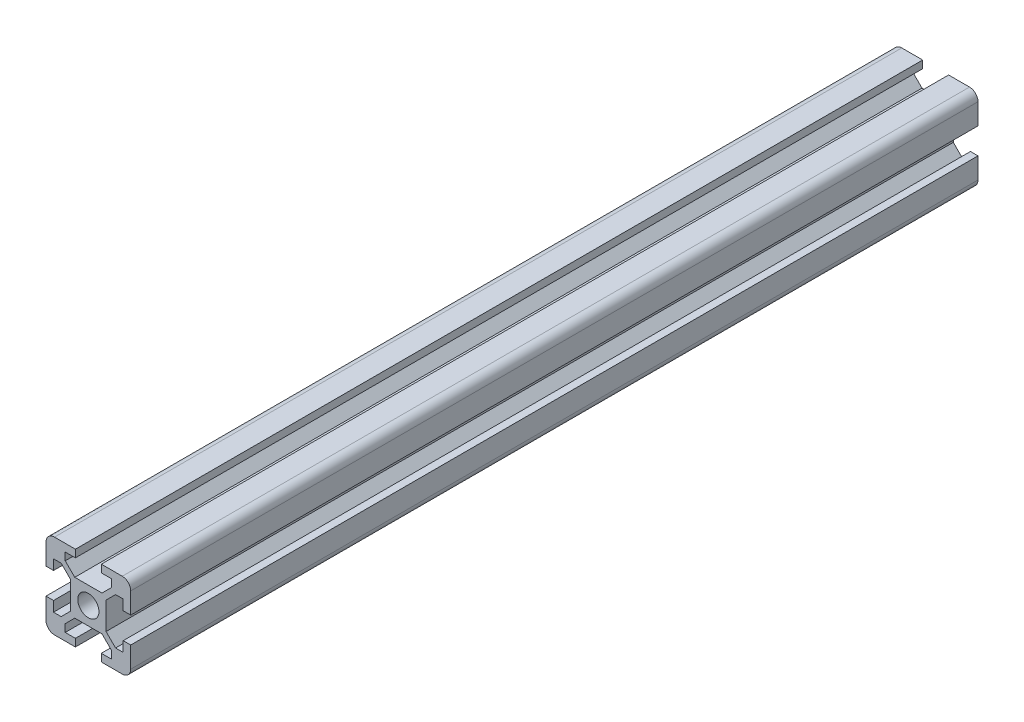
from build123d import *

# Parameters (mm, degrees)
SKETCH1_R           = 2.5
BOSS_EXTRUDE1_DEPTH = 200
FILLET1_R           = 2


with BuildPart() as part:
    # Sketch1 → Boss-Extrude1 (new body)
    with BuildSketch(Plane.XY):
        Polygon((-5.46, -6.42), (-3.215, -4.175), (3.215, -4.175), (5.46, -6.42), (5.46, -8.22), (3.06, -8.22), (3.06, -10), (10, -10), (10, -3.06), (8.22, -3.06), (8.22, -5.46), (6.42, -5.46), (4.175, -3.215), (4.175, 3.215), (6.42, 5.46), (8.22, 5.46), (8.22, 3.06), (10, 3.06), (10, 10), (3.06, 10), (3.06, 8.22), (5.46, 8.22), (5.46, 6.42), (3.215, 4.175), (-3.215, 4.175), (-5.46, 6.42), (-5.46, 8.22), (-3.06, 8.22), (-3.06, 10), (-10, 10), (-10, 3.06), (-8.22, 3.06), (-8.22, 5.46), (-6.42, 5.46), (-4.175, 3.215), (-4.175, -3.215), (-6.42, -5.46), (-8.22, -5.46), (-8.22, -3.06), (-10, -3.06), (-10, -10), (-3.06, -10), (-3.06, -8.22), (-5.46, -8.22), align=None)
        Circle(SKETCH1_R, mode=Mode.SUBTRACT)
    extrude(amount=BOSS_EXTRUDE1_DEPTH)

    # Fillet1
    fillet1_edges = [part.edges().sort_by_distance(p)[0] for p in [
        (10, -10, 100),
        (-10, -10, 100),
        (-10, 10, 100),
        (10, 10, 100),
    ]]
    fillet(fillet1_edges, radius=FILLET1_R)


solid = part.part
